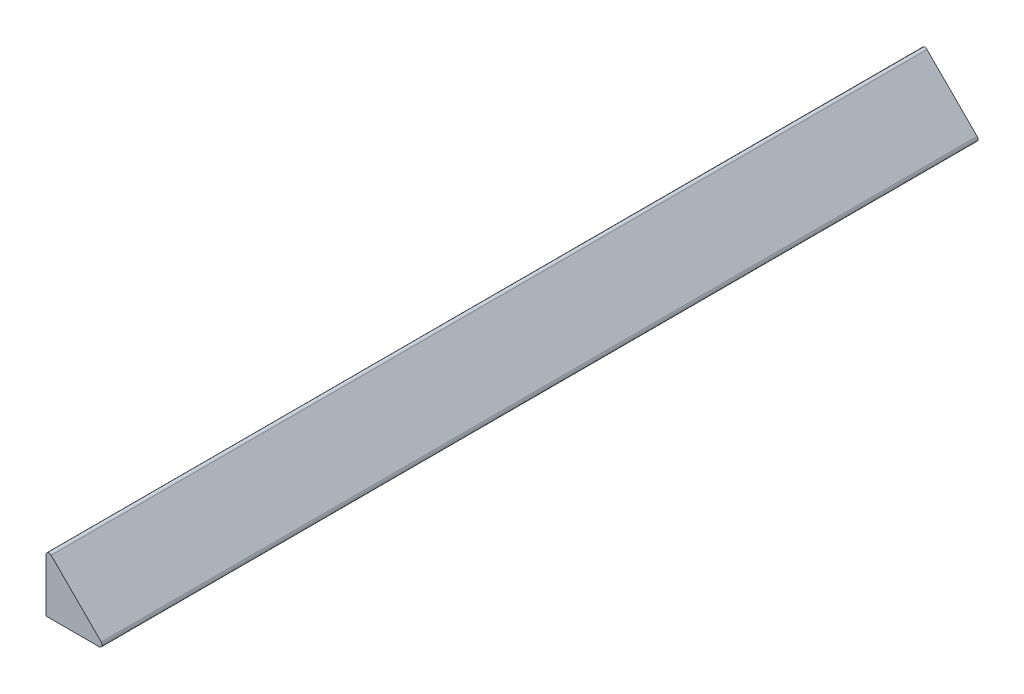
from build123d import *

# Parameters (mm, degrees)
EXTRUDE_1_DEPTH = 290
FILLET_1_R      = 1


with BuildPart() as part:
    # Эскиз1 → Бобышка-Вытянуть1 (new body)
    with BuildSketch(Plane.XY):
        Polygon((0, 0), (0, 20), (20, 0), align=None)
    extrude(amount=-EXTRUDE_1_DEPTH)

    # Скругление1
    fillet_1_edges = [part.edges().sort_by_distance(p)[0] for p in [
        (0, 20, -145),
        (20, 0, -145),
    ]]
    fillet(fillet_1_edges, radius=FILLET_1_R)


solid = part.part
